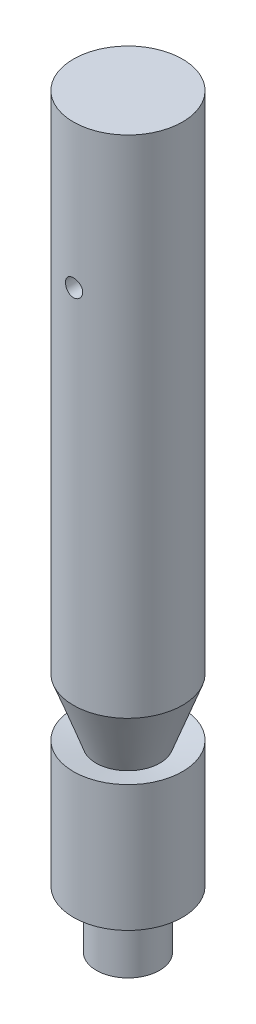
from build123d import *

# Parameters (mm, degrees)
CROQUIS1_R                 = 9.5
SALIENTE_EXTRUIR1_DEPTH    = 120
CROQUIS3_R                 = 5.5
SALIENTE_EXTRUIR2_DEPTH    = 10
CROQUIS4_R                 = 2.5
CORTAR_EXTRUIR1_DEPTH      = 110
CORTAR_EXTRUIR2_DEPTH      = 110
CORTAR_EXTRUIR2_DEPTH_BACK = 110
CROQUIS5_R                 = 1.5


with BuildPart() as part:
    # Croquis1 → Saliente-Extruir1 (new body)
    with BuildSketch(Plane(origin=(0, 0, 0), x_dir=(1, 0, 0), z_dir=(0, 1, 0))):
        Circle(CROQUIS1_R)
    extrude(amount=SALIENTE_EXTRUIR1_DEPTH)

    # Croquis2 → Cortar-Revolución1 (revolve, cut)
    with BuildSketch(Plane.XY):
        Polygon((-9.5, 22), (-9.5, 32), (-5.560768988, 21.305407289), align=None)
    revolve(axis=Axis((0, 120, 0), (0, -1, 0)), mode=Mode.SUBTRACT)

    # Croquis3 → Saliente-Extruir2 (add)
    with BuildSketch(Plane.XZ):
        Circle(CROQUIS3_R)
    extrude(amount=SALIENTE_EXTRUIR2_DEPTH)

    # Croquis4 → Cortar-Extruir1 (cut)
    with BuildSketch(Plane.XZ.offset(10)):
        Circle(CROQUIS4_R)
    extrude(amount=-CORTAR_EXTRUIR1_DEPTH, mode=Mode.SUBTRACT)

    # Croquis5 → Cortar-Extruir2 (cut, two sides: drawn at the far end of the back side and taken through both)
    with BuildSketch(Plane.XY.offset(-CORTAR_EXTRUIR2_DEPTH_BACK)):
        with Locations((0, 95)):
            Circle(CROQUIS5_R)
    extrude(amount=CORTAR_EXTRUIR2_DEPTH + CORTAR_EXTRUIR2_DEPTH_BACK, mode=Mode.SUBTRACT)


solid = part.part
